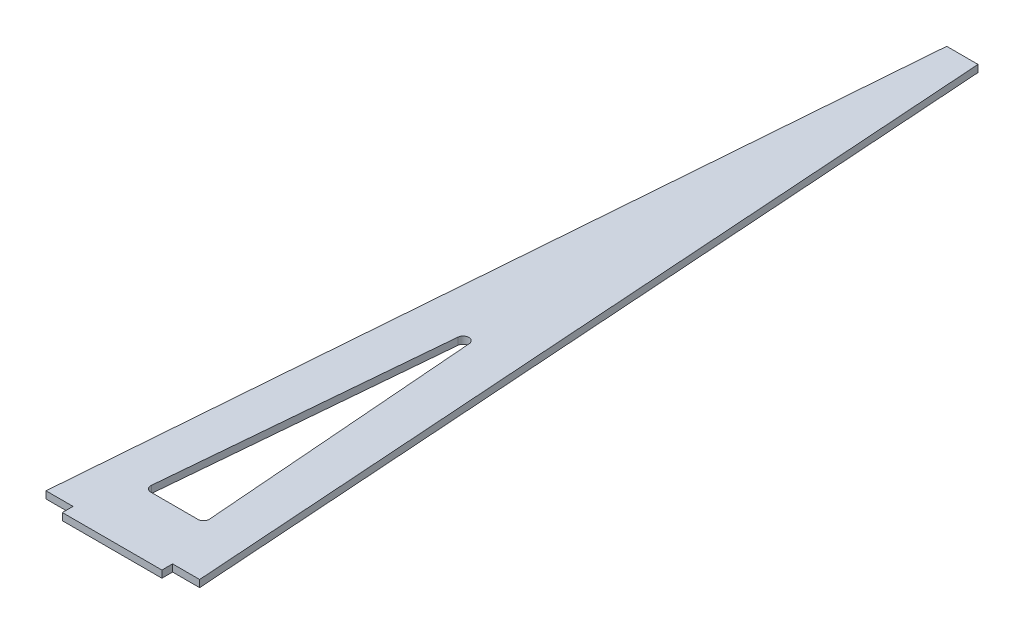
from build123d import *

# Parameters (mm, degrees)
BOSS_EXTRUDE1_DEPTH = 3.175
CUT_EXTRUDE1_DEPTH  = 3.175
FILLET1_R           = 2.54
SKETCH3_W           = 44.45
SKETCH3_H           = 3.175
BOSS_EXTRUDE2_DEPTH = 4.7625
CUT_EXTRUDE2_DEPTH  = 375.826918736


with BuildPart() as part:
    # Sketch1 → Boss-Extrude1 (new body)
    with BuildSketch(Plane(origin=(0, 0, 0), x_dir=(1, 0, 0), z_dir=(0, 1, 0))):
        Polygon((0, 0), (-38.1, 0), (-5.08, 372.872), (0, 372.872), (8.89, 372.872), (38.1, 0), align=None)
    extrude(amount=BOSS_EXTRUDE1_DEPTH)

    # Sketch2 → Cut-Extrude1 (cut)
    with BuildSketch(Plane(origin=(0, 3.175, 0), x_dir=(1, 0, 0), z_dir=(0, 1, 0))):
        Polygon((13.379159589, 22.86), (0.937890665, 181.675502439), (-13.126152466, 22.86), align=None)
    extrude(amount=-CUT_EXTRUDE1_DEPTH, mode=Mode.SUBTRACT)

    # Fillet1
    fillet1_edges = [part.edges().sort_by_distance(p)[0] for p in [
        (-13.126152466, 1.5875, -22.86),
        (0.937890665, 1.5875, -181.675502439),
        (13.379159589, 1.5875, -22.86),
    ]]
    fillet(fillet1_edges, radius=FILLET1_R)

    # Sketch3 → Boss-Extrude2 (add)
    with BuildSketch(Plane.XY):
        with Locations((0, 1.5875)):
            Rectangle(SKETCH3_W, SKETCH3_H)
    extrude(amount=BOSS_EXTRUDE2_DEPTH)

    # Sketch4 → Cut-Extrude2 (cut, through all)
    with BuildSketch(Plane(origin=(0, 3.175, 0), x_dir=(1, 0, 0), z_dir=(0, 1, 0))):
        Polygon((-5.08, 372.872), (-34.29, 0), (-38.1, 0), align=None)
        Polygon((38.1, 0), (8.89, 372.872), (34.29, 0), align=None)
    extrude(amount=-CUT_EXTRUDE2_DEPTH, mode=Mode.SUBTRACT)


solid = part.part
